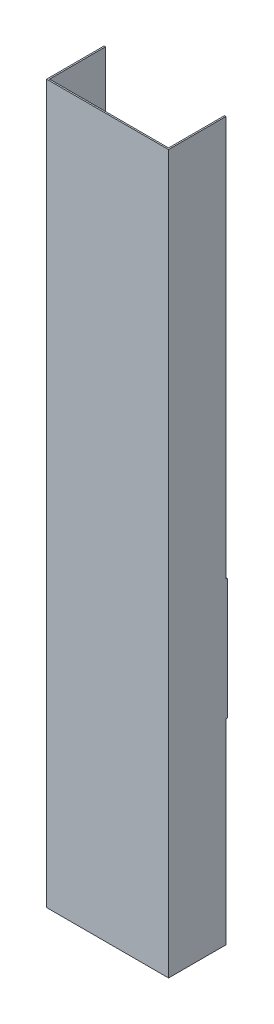
from build123d import *

# Parameters (mm, degrees)
BOSS_EXTRUDE1_DEPTH = 500
SKETCH2_W           = 85
SKETCH2_H           = 84.213763161
BOSS_EXTRUDE2_DEPTH = 1


with BuildPart() as part:
    # Sketch1 → Boss-Extrude1 (new body)
    with BuildSketch(Plane(origin=(0, 0, 0), x_dir=(1, 0, 0), z_dir=(0, 1, 0))):
        Polygon((0, 0), (0, -40), (85, -40), (85, 0), (84, 0), (84, -39), (1, -39), (1, 0), align=None)
    extrude(amount=BOSS_EXTRUDE1_DEPTH)

    # Sketch2 → Boss-Extrude2 (add)
    with BuildSketch(Plane(origin=(0, 0, 0), x_dir=(-1, 0, 0), z_dir=(0, 0, -1))):
        with Locations((-42.5, 178.588682327)):
            Rectangle(SKETCH2_W, SKETCH2_H)
    extrude(amount=BOSS_EXTRUDE2_DEPTH)


solid = part.part
